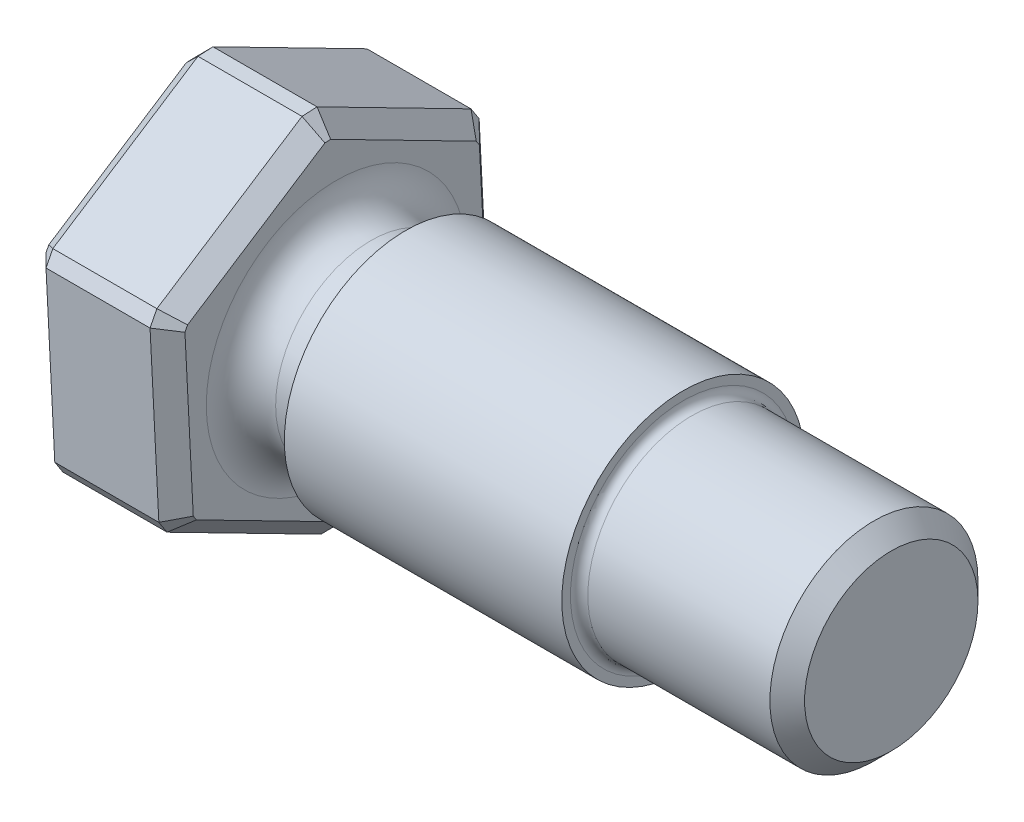
from build123d import *

# Parameters (mm, degrees)
SCHIZZO1_R          = 7
ESTRUSIONE1_DEPTH   = 20
SCHIZZO2_R          = 6
ESTRUSIONE2_DEPTH   = 12
ESTRUSIONE3_DEPTH   = 8
SCHIZZO4_OUTSIDE_W  = 31.456
SCHIZZO4_OUTSIDE_H  = 33.832
SCHIZZO4_OUTSIDE_R  = 5.5
ESTRUSIONE4_DEPTH   = 4
SMUSSO1_SIZE        = 0.5
SMUSSO1_EDGE_2_SIZE = 0.5
SMUSSO1_EDGE_3_SIZE = 0.5
SMUSSO1_EDGE_4_SIZE = 0.5
SMUSSO1_EDGE_5_SIZE = 0.5
SMUSSO1_EDGE_6_SIZE = 0.5
SMUSSO2_SIZE        = 1
RACCORDO1_R         = 2
RACCORDO2_R         = 0.5
SMUSSO3_SIZE        = 1


with BuildPart() as part:
    # Schizzo1 → Estrusione1 (new body)
    with BuildSketch(Plane(origin=(0, 0, 0), x_dir=(0, 0, -1), z_dir=(1, 0, 0))):
        Circle(SCHIZZO1_R)
    extrude(amount=ESTRUSIONE1_DEPTH)

    # Schizzo2 → Estrusione2 (add)
    with BuildSketch(Plane(origin=(20, 0, 0), x_dir=(0, 0, -1), z_dir=(1, 0, 0))):
        Circle(SCHIZZO2_R)
    extrude(amount=ESTRUSIONE2_DEPTH)

    # Schizzo3 → Estrusione3 (add)
    with BuildSketch(Plane.ZY):
        Polygon((9.208732283, -5.960921327), (9.766675441, 4.99453543), (0.557943158, 10.955456758), (-9.208732283, 5.960921327), (-9.766675441, -4.99453543), (-0.557943158, -10.955456758), align=None)
    extrude(amount=ESTRUSIONE3_DEPTH)

    # Schizzo4 outside → Estrusione4 (cut)
    with BuildSketch(Plane(origin=(0, 0, 0), x_dir=(0, 0, -1), z_dir=(1, 0, 0))):
        Rectangle(SCHIZZO4_OUTSIDE_W, SCHIZZO4_OUTSIDE_H)
        Circle(SCHIZZO4_OUTSIDE_R, mode=Mode.SUBTRACT)
    extrude(amount=ESTRUSIONE4_DEPTH, mode=Mode.SUBTRACT)

    # Smusso1
    smusso1_edges = [part.edges().sort_by_distance(p)[0] for p in [
        (-4, -5.960921327, 9.208732283),
    ]]
    chamfer(smusso1_edges, length=SMUSSO1_SIZE)

    # Smusso1 edge 2
    smusso1_edge_2_edges = [part.edges().sort_by_distance(p)[0] for p in [
        (-4, 4.99453543, 9.766675441),
    ]]
    chamfer(smusso1_edge_2_edges, length=SMUSSO1_EDGE_2_SIZE)

    # Smusso1 edge 3
    smusso1_edge_3_edges = [part.edges().sort_by_distance(p)[0] for p in [
        (-4, 10.955456758, 0.557943158),
    ]]
    chamfer(smusso1_edge_3_edges, length=SMUSSO1_EDGE_3_SIZE)

    # Smusso1 edge 4
    smusso1_edge_4_edges = [part.edges().sort_by_distance(p)[0] for p in [
        (-4, 5.960921327, -9.208732283),
    ]]
    chamfer(smusso1_edge_4_edges, length=SMUSSO1_EDGE_4_SIZE)

    # Smusso1 edge 5
    smusso1_edge_5_edges = [part.edges().sort_by_distance(p)[0] for p in [
        (-4, -4.99453543, -9.766675441),
    ]]
    chamfer(smusso1_edge_5_edges, length=SMUSSO1_EDGE_5_SIZE)

    # Smusso1 edge 6
    smusso1_edge_6_edges = [part.edges().sort_by_distance(p)[0] for p in [
        (-4, -10.955456758, -0.557943158),
    ]]
    chamfer(smusso1_edge_6_edges, length=SMUSSO1_EDGE_6_SIZE)

    # Smusso2
    smusso2_edges = [part.edges().sort_by_distance(p)[0] for p in [
        (0, -8.458189042, 4.325394563),
        (-8, -8.458189042, 4.325394563),
        (0, -7.974996094, -5.162309299),
        (0, 0.483192949, -9.487703862),
        (0, 8.458189042, -4.325394563),
        (0, 7.974996094, 5.162309299),
        (0, -0.483192949, 9.487703862),
        (0, 4.880709257, 9.544091519),
        (0, -5.825071083, 8.998863965),
        (0, 10.70578034, 0.545227554),
        (0, 5.825071083, -8.998863965),
        (0, -4.880709257, -9.544091519),
        (0, -10.70578034, -0.545227554),
        (-8, -7.974996094, -5.162309299),
        (-8, -0.483192949, 9.487703862),
        (-8, 7.974996094, 5.162309299),
        (-8, 8.458189042, -4.325394563),
        (-8, 0.483192949, -9.487703862),
        (-8, 4.880709257, 9.544091519),
        (-8, -5.825071083, 8.998863965),
        (-8, 10.70578034, 0.545227554),
        (-8, 5.825071083, -8.998863965),
        (-8, -4.880709257, -9.544091519),
        (-8, -10.70578034, -0.545227554),
    ]]
    chamfer(smusso2_edges, length=SMUSSO2_SIZE)

    # Raccordo1
    raccordo1_edges = [part.edges().sort_by_distance(p)[0] for p in [
        (0, 0, 5.5),
    ]]
    fillet(raccordo1_edges, radius=RACCORDO1_R)

    # Raccordo2
    raccordo2_edges = [part.edges().sort_by_distance(p)[0] for p in [
        (4, 0, 5.5),
        (20, 0, 6),
    ]]
    fillet(raccordo2_edges, radius=RACCORDO2_R)

    # Smusso3
    smusso3_edges = [part.edges().sort_by_distance(p)[0] for p in [
        (32, 0, 6),
    ]]
    chamfer(smusso3_edges, length=SMUSSO3_SIZE)


solid = part.part
